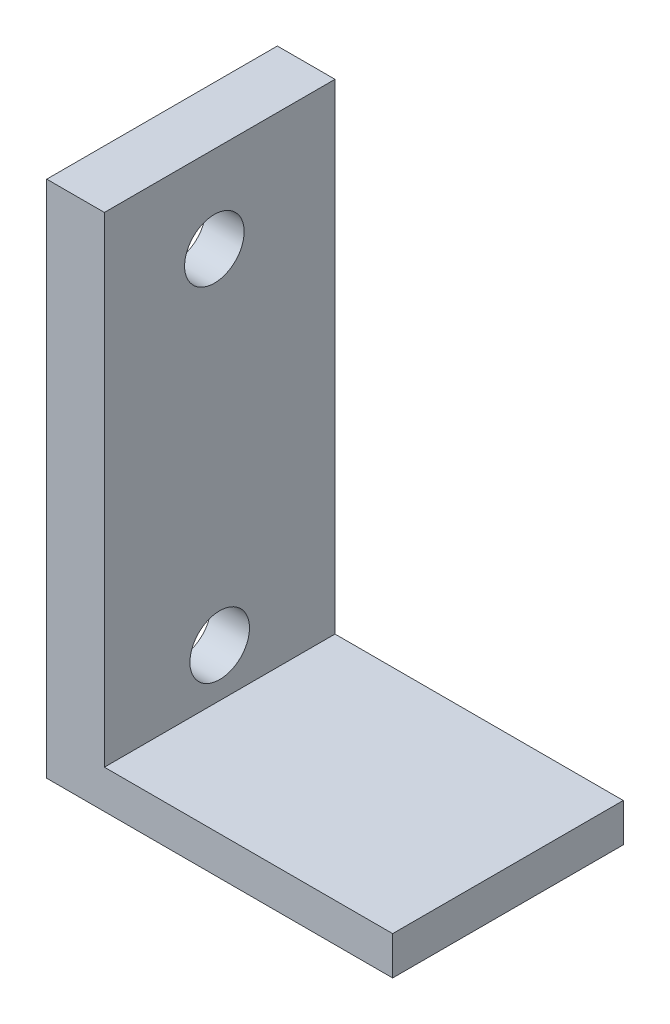
from build123d import *

# Parameters (mm, degrees)
BOSS_EXTRUDE1_DEPTH = 12
SKETCH2_R           = 3.5
CUT_EXTRUDE1_DEPTH  = 1
SKETCH3_R           = 1.55
CUT_EXTRUDE2_DEPTH  = 3.1
SKETCH5_R           = 1.55
CUT_EXTRUDE3_DEPTH  = 11


with BuildPart() as part:
    # Sketch1 → Boss-Extrude1 (new body)
    with BuildSketch(Plane.XY):
        Polygon((0, 13.037037037), (-3, 13.037037037), (-3, -13.962962963), (15, -13.962962963), (15, -11.962962963), (0, -11.962962963), align=None)
    extrude(amount=BOSS_EXTRUDE1_DEPTH)

    # Sketch2 → Cut-Extrude1 (cut)
    with BuildSketch(Plane.ZY.offset(3)):
        with Locations(Location((6.055399975, -9.462962963, 0), (0, 0, 270))):
            Circle(SKETCH2_R)
        with Locations(Location((6.276999876, 8.537037037, 0), (0, 0, 270))):
            Circle(SKETCH2_R)
    extrude(amount=-CUT_EXTRUDE1_DEPTH, mode=Mode.SUBTRACT)

    # Sketch3 → Cut-Extrude2 (cut)
    with BuildSketch(Plane.ZY.offset(3)):
        with Locations(Location((6.276999876, 8.537037037, 0), (0, 0, 270))):
            Circle(SKETCH3_R)
    extrude(amount=-CUT_EXTRUDE2_DEPTH, mode=Mode.SUBTRACT)

    # Sketch5 → Cut-Extrude3 (cut)
    with BuildSketch(Plane(origin=(0, 0, 0), x_dir=(0, 0, -1), z_dir=(1, 0, 0))):
        with Locations(Location((-6, -9.462962963, 0), (0, 0, 90))):
            Circle(SKETCH5_R)
    extrude(amount=-CUT_EXTRUDE3_DEPTH, mode=Mode.SUBTRACT)


solid = part.part
